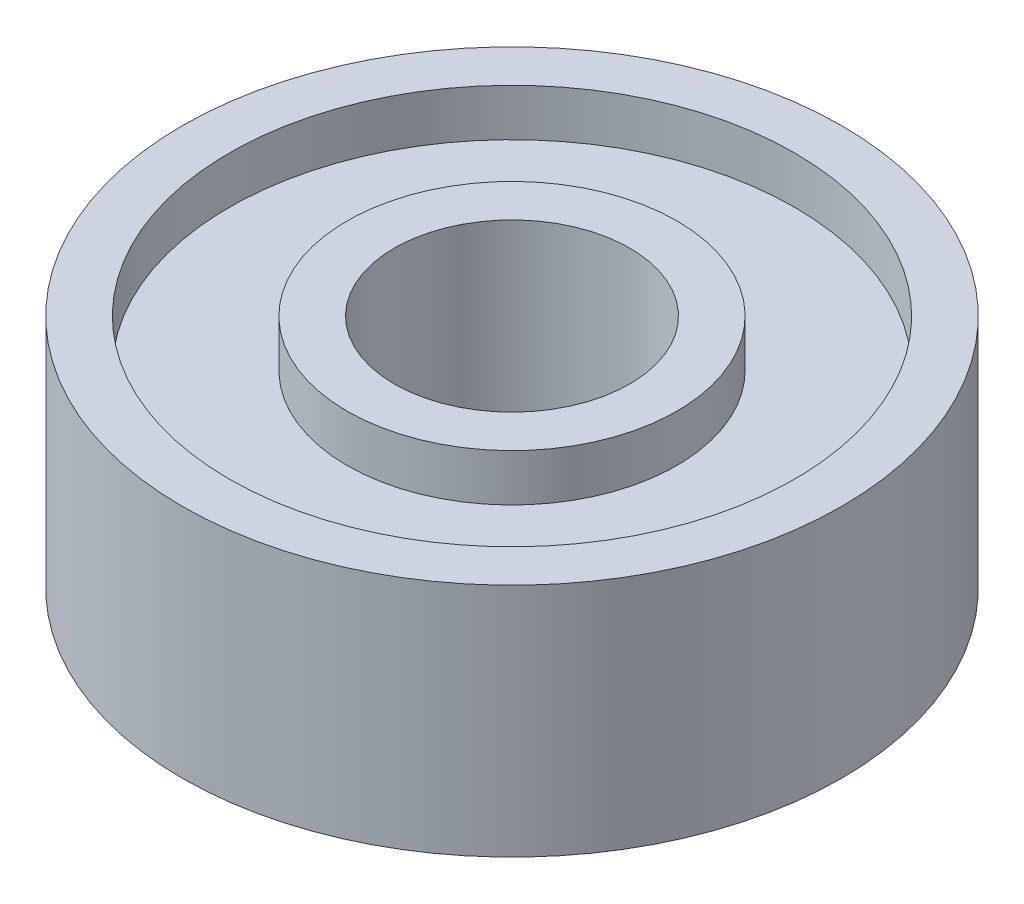
from build123d import *

# Parameters (mm, degrees)
SKETCH_1_R          = 7
SKETCH_1_R_2        = 2.5
EXTRUDE_1_DEPTH     = 5
SKETCH_2_R          = 6
SKETCH_2_R_2        = 3.5
CUT_EXTRUDE_1_DEPTH = 1
CUT_EXTRUDE_START   = -1
SKETCH_3_R          = 6
SKETCH_3_R_2        = 3.5
CUT_EXTRUDE_2_DEPTH = 1


with BuildPart() as part:
    # 스케치1 → 보스-돌출1 (new body)
    with BuildSketch(Plane(origin=(0, 0, 0), x_dir=(1, 0, 0), z_dir=(0, 1, 0))):
        with Locations(Location((0, 0, 0), (0, 0, 270))):
            Circle(SKETCH_1_R)
        with Locations(Location((0, 0, 0), (0, 0, 270))):
            Circle(SKETCH_1_R_2, mode=Mode.SUBTRACT)
    extrude(amount=EXTRUDE_1_DEPTH)

    # 스케치2 → 컷-돌출1 (cut)
    with BuildSketch(Plane(origin=(0, 5, 0), x_dir=(1, 0, 0), z_dir=(0, 1, 0))):
        with Locations(Location((0, 0, 0), (0, 0, 270))):
            Circle(SKETCH_2_R)
        with Locations(Location((0, 0, 0), (0, 0, 270))):
            Circle(SKETCH_2_R_2, mode=Mode.SUBTRACT)
    extrude(amount=-CUT_EXTRUDE_1_DEPTH, mode=Mode.SUBTRACT)

    # 스케치3 → 컷-돌출2 (cut)
    with BuildSketch(Plane(origin=(0, 0, 0), x_dir=(-1, 0, 0), z_dir=(0, -1, 0)).offset(CUT_EXTRUDE_START)):
        with Locations(Location((0, 0, 0), (0, 0, 270))):
            Circle(SKETCH_3_R)
        with Locations(Location((0, 0, 0), (0, 0, 270))):
            Circle(SKETCH_3_R_2, mode=Mode.SUBTRACT)
    extrude(amount=CUT_EXTRUDE_2_DEPTH, mode=Mode.SUBTRACT)


solid = part.part
